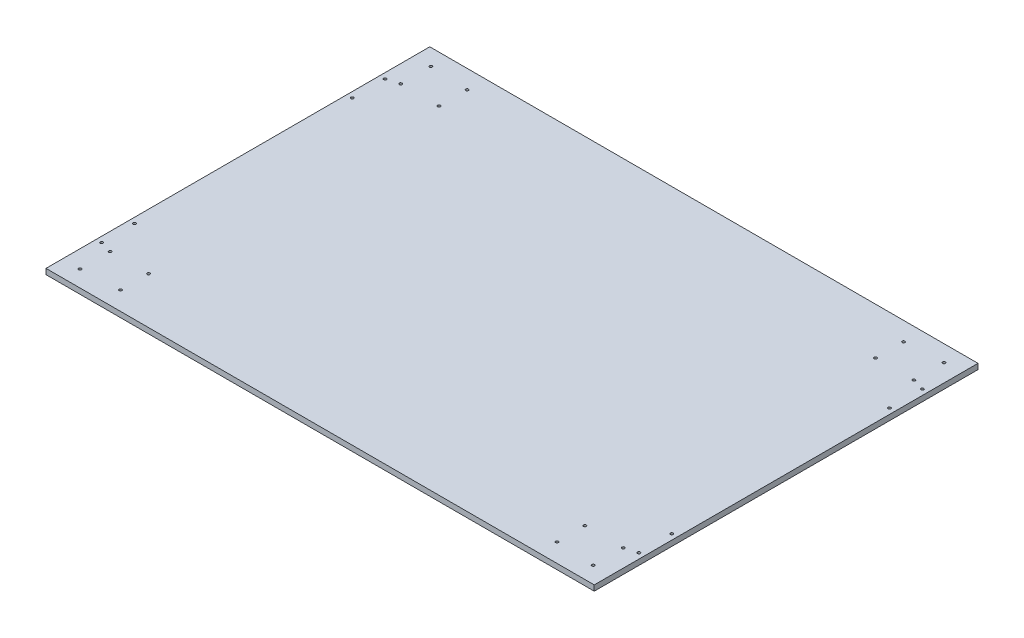
from build123d import *

# Parameters (mm, degrees)
SKETCH1_W           = 1270
SKETCH1_H           = 889
BOSS_EXTRUDE1_DEPTH = 12.7
SKETCH3_R           = 3.175
CUT_EXTRUDE4_DEPTH  = 12.192
SKETCH4_R           = 3.175
SKETCH4_R_2         = 0.038547113
CUT_EXTRUDE6_DEPTH  = 445.516


with BuildPart() as part:
    # Sketch1 → Boss-Extrude1 (new body)
    with BuildSketch(Plane(origin=(0, 0, 0), x_dir=(1, 0, 0), z_dir=(0, 1, 0))):
        Rectangle(SKETCH1_W, SKETCH1_H)
    extrude(amount=BOSS_EXTRUDE1_DEPTH)

    # Sketch3 → Cut-Extrude4 (cut)
    with BuildSketch(Plane(origin=(0, 12.7, 0), x_dir=(1, 0, 0), z_dir=(0, 1, 0))):
        with Locations(Location((-594.36, 406.4, 0), (0, 0, 270))):
            Circle(SKETCH3_R)
        with Locations(Location((-505.601038797, 401.394322612, 0), (0, 0, 270))):
            Circle(SKETCH3_R)
        with Locations(Location((-594.36, 336.55, 0), (0, 0, 270))):
            Circle(SKETCH3_R)
        with Locations(Location((-505.46, 336.55, 0), (0, 0, 270))):
            Circle(SKETCH3_R)
        with Locations(Location((505.601038797, 401.394322612, 0), (0, 0, 270))):
            Circle(SKETCH3_R)
        with Locations(Location((505.46, 336.55, 0), (0, 0, 270))):
            Circle(SKETCH3_R)
        with Locations(Location((594.36, 336.55, 0), (0, 0, 270))):
            Circle(SKETCH3_R)
        with Locations(Location((594.36, 406.4, 0), (0, 0, 270))):
            Circle(SKETCH3_R)
        with Locations(Location((505.46, -336.55, 0), (0, 0, 270))):
            Circle(SKETCH3_R)
        with Locations(Location((505.601038797, -401.394322612, 0), (0, 0, 270))):
            Circle(SKETCH3_R)
        with Locations(Location((594.36, -406.4, 0), (0, 0, 270))):
            Circle(SKETCH3_R)
        with Locations(Location((594.36, -336.55, 0), (0, 0, 270))):
            Circle(SKETCH3_R)
        with Locations(Location((-505.46, -336.55, 0), (0, 0, 270))):
            Circle(SKETCH3_R)
        with Locations(Location((-505.601038797, -401.394322612, 0), (0, 0, 270))):
            Circle(SKETCH3_R)
        with Locations(Location((-594.36, -336.55, 0), (0, 0, 270))):
            Circle(SKETCH3_R)
        with Locations(Location((-594.36, -406.4, 0), (0, 0, 270))):
            Circle(SKETCH3_R)
    extrude(amount=-CUT_EXTRUDE4_DEPTH, mode=Mode.SUBTRACT)

    # Sketch4 → Cut-Extrude6 (cut)
    # profile 1 of 8: a face of its own
    with BuildSketch(Plane(origin=(0, 12.7, 0), x_dir=(1, 0, 0), z_dir=(0, 1, 0))):
        with Locations(Location((-622.3, 328.295, 0), (0, 0, 270))):
            Circle(SKETCH4_R)
        with Locations(Location((-622.3, 328.295, 0), (0, 0, 270))):
            Circle(SKETCH4_R_2, mode=Mode.SUBTRACT)
    # profile 2 of 8: a face of its own
    with BuildSketch(Plane(origin=(0, 12.7, 0), x_dir=(1, 0, 0), z_dir=(0, 1, 0))):
        with Locations(Location((-622.3, 252.095, 0), (0, 0, 270))):
            Circle(SKETCH4_R)
    # profile 3 of 8: a face of its own
    with BuildSketch(Plane(origin=(0, 12.7, 0), x_dir=(1, 0, 0), z_dir=(0, 1, 0))):
        with Locations(Location((622.3, 252.095, 0), (0, 0, 270))):
            Circle(SKETCH4_R)
    # profile 4 of 8: a face of its own
    with BuildSketch(Plane(origin=(0, 12.7, 0), x_dir=(1, 0, 0), z_dir=(0, 1, 0))):
        with Locations(Location((622.3, 328.295, 0), (0, 0, 270))):
            Circle(SKETCH4_R)
    # profile 5 of 8: a face of its own
    with BuildSketch(Plane(origin=(0, 12.7, 0), x_dir=(1, 0, 0), z_dir=(0, 1, 0))):
        with Locations(Location((622.3, -252.095, 0), (0, 0, 270))):
            Circle(SKETCH4_R)
    # profile 6 of 8: a face of its own
    with BuildSketch(Plane(origin=(0, 12.7, 0), x_dir=(1, 0, 0), z_dir=(0, 1, 0))):
        with Locations(Location((622.3, -328.295, 0), (0, 0, 270))):
            Circle(SKETCH4_R)
    # profile 7 of 8: a face of its own
    with BuildSketch(Plane(origin=(0, 12.7, 0), x_dir=(1, 0, 0), z_dir=(0, 1, 0))):
        with Locations(Location((-622.3, -252.095, 0), (0, 0, 270))):
            Circle(SKETCH4_R)
    # profile 8 of 8: a face of its own
    with BuildSketch(Plane(origin=(0, 12.7, 0), x_dir=(1, 0, 0), z_dir=(0, 1, 0))):
        with Locations(Location((-622.3, -328.295, 0), (0, 0, 270))):
            Circle(SKETCH4_R)
    extrude(amount=-CUT_EXTRUDE6_DEPTH, mode=Mode.SUBTRACT)


with BuildPart() as cut_extrude6_piece_1:
    # of the separate pieces the step leaves, piece 1, a body of its own (cut_extrude6_pieces)
    add(part.part.solids().sort_by_distance((-635, 0, -444.5))[0])


with BuildPart() as cut_extrude6_piece_2:
    # of the separate pieces the step leaves, piece 2, a body of its own (cut_extrude6_pieces)
    add(part.part.solids().sort_by_distance((-622.3, 0, -328.256452887))[0])


solid = Compound([cut_extrude6_piece_1.part, cut_extrude6_piece_2.part])
